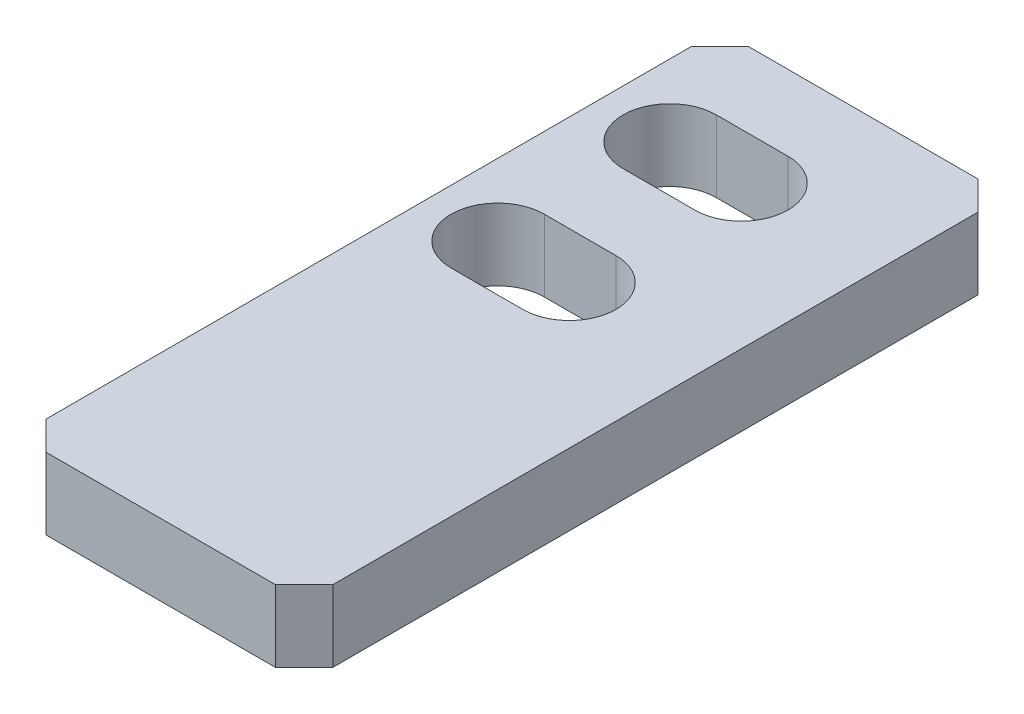
from build123d import *

# Parameters (mm, degrees)
BOSS_EXTRUDE1_DEPTH = 5
SKETCH1_5_OUTSIDE_W = 32.632
SKETCH1_5_OUTSIDE_H = 61.632
CUT_EXTRUDE5_DEPTH  = 5


with BuildPart() as part:
    # Sketch1 → Boss-Extrude1 (new body)
    with BuildSketch(Plane(origin=(0, 0, 0), x_dir=(1, 0, 0), z_dir=(0, 1, 0))):
        Polygon((0, 47), (2, 49), (18, 49), (20, 47), (20, 2), (18, 0), (2, 0), (0, 2), align=None)
    extrude(amount=BOSS_EXTRUDE1_DEPTH)

    # Sketch1<5> outside → Cut-Extrude5 (cut)
    # profile 1 of 3: a face of its own
    with BuildSketch(Plane(origin=(0, 0, 0), x_dir=(1, 0, 0), z_dir=(0, 1, 0))):
        with Locations((10, 24.5)):
            Rectangle(SKETCH1_5_OUTSIDE_W, SKETCH1_5_OUTSIDE_H)
        Polygon((0, 47), (2, 49), (18, 49), (20, 47), (20, 2), (18, 0), (2, 0), (0, 2), align=None, mode=Mode.SUBTRACT)
    # profile 2 of 3: a face of its own
    with BuildSketch(Plane(origin=(0, 0, 0), x_dir=(1, 0, 0), z_dir=(0, 1, 0))):
        with BuildLine():
            Line((10, 37.25), (5, 37.25))
            ThreePointArc((5, 37.25), (1.75, 40.5), (5, 43.75))
            Line((5, 43.75), (10, 43.75))
            ThreePointArc((10, 43.75), (13.25, 40.5), (10, 37.25))
        make_face()
    # profile 3 of 3: a face of its own
    with BuildSketch(Plane(origin=(0, 0, 0), x_dir=(1, 0, 0), z_dir=(0, 1, 0))):
        with BuildLine():
            Line((5, 31.75), (10, 31.75))
            ThreePointArc((10, 31.75), (13.25, 28.5), (10, 25.25))
            Line((10, 25.25), (5, 25.25))
            ThreePointArc((5, 25.25), (1.75, 28.5), (5, 31.75))
        make_face()
    extrude(amount=CUT_EXTRUDE5_DEPTH, mode=Mode.SUBTRACT)


solid = part.part
